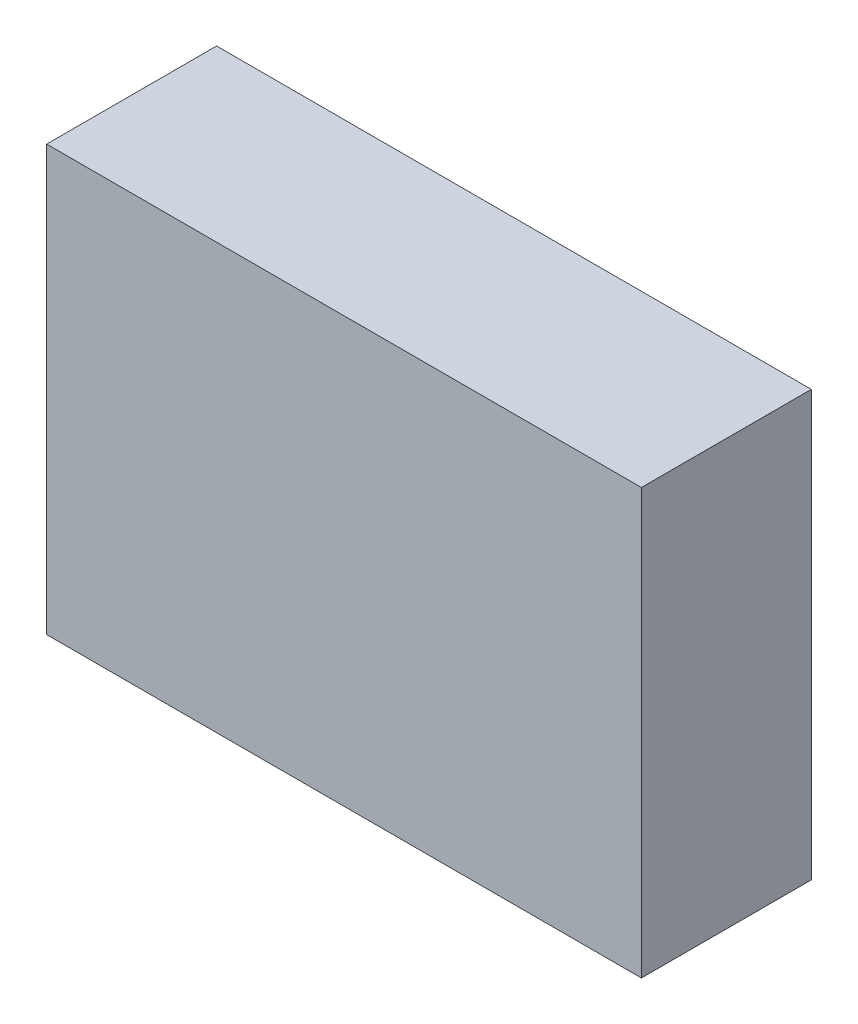
from build123d import *

# Parameters (mm, degrees)
SKETCH_1_W      = 70
SKETCH_1_H      = 50
EXTRUDE_1_DEPTH = 20


with BuildPart() as part:
    # Эскиз1 → Бобышка-Вытянуть1 (new body)
    with BuildSketch(Plane.XY):
        with Locations((35, 25)):
            Rectangle(SKETCH_1_W, SKETCH_1_H)
    extrude(amount=EXTRUDE_1_DEPTH)


solid = part.part
